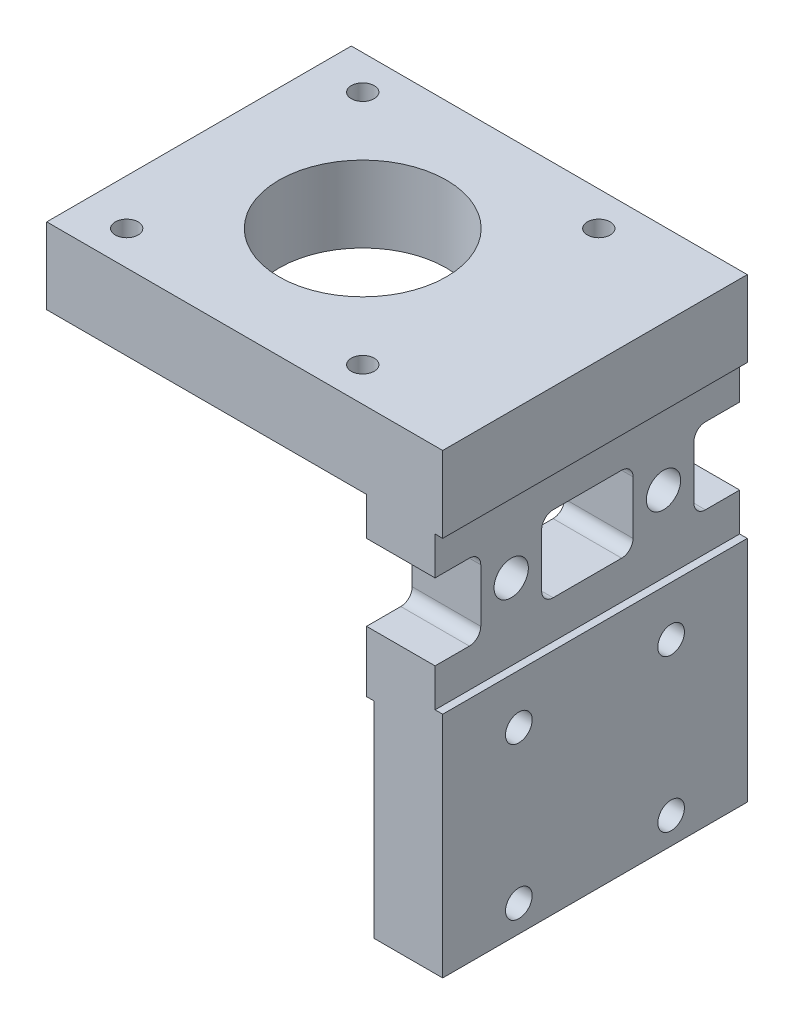
from build123d import *

# Parameters (mm, degrees)
SKETCH1_W           = 40
SKETCH1_H           = 50
BOSS_EXTRUDE1_DEPTH = 10
SKETCH2_W           = 40
SKETCH2_H           = 27
CUT_EXTRUDE1_DEPTH  = 1
SKETCH3_R           = 1.75
CUT_EXTRUDE2_DEPTH  = 10
SKETCH4_W           = 40
SKETCH4_H           = 20
CUT_EXTRUDE3_DEPTH  = 1
SKETCH6_R           = 2.25
CUT_EXTRUDE4_DEPTH  = 10
SKETCH7_W           = 52
SKETCH7_H           = 40
BOSS_EXTRUDE2_DEPTH = 10
SKETCH8_R           = 11
CUT_EXTRUDE5_DEPTH  = 10
SKETCH9_W           = 6
SKETCH9_H           = 10
SKETCH9_W_2         = 12
CUT_EXTRUDE6_DEPTH  = 10
SKETCH10_R          = 1.5
CUT_EXTRUDE7_DEPTH  = 10
FILLET1_R           = 1.5
FILLET2_R           = 1.5


with BuildPart() as part:
    # Sketch1 → Boss-Extrude1 (new body)
    with BuildSketch(Plane(origin=(0, 0, 0), x_dir=(0, 0, -1), z_dir=(1, 0, 0))):
        with Locations((20, 26.83908046)):
            Rectangle(SKETCH1_W, SKETCH1_H)
    extrude(amount=BOSS_EXTRUDE1_DEPTH)

    # Sketch2 → Cut-Extrude1 (cut)
    with BuildSketch(Plane.ZY):
        with Locations((-20, 15.33908046)):
            Rectangle(SKETCH2_W, SKETCH2_H)
    extrude(amount=-CUT_EXTRUDE1_DEPTH, mode=Mode.SUBTRACT)

    # Sketch3 → Cut-Extrude2 (cut)
    with BuildSketch(Plane(origin=(10, 0, 0), x_dir=(0, 0, -1), z_dir=(1, 0, 0))):
        with Locations((10, 25.33908046)):
            Circle(SKETCH3_R)
        with Locations((30, 25.33908046)):
            Circle(SKETCH3_R)
        with Locations((30, 5.33908046)):
            Circle(SKETCH3_R)
        with Locations((10, 5.33908046)):
            Circle(SKETCH3_R)
    extrude(amount=-CUT_EXTRUDE2_DEPTH, mode=Mode.SUBTRACT)

    # Sketch4 → Cut-Extrude3 (cut)
    with BuildSketch(Plane(origin=(10, 0, 0), x_dir=(0, 0, -1), z_dir=(1, 0, 0))):
        with Locations((20, 41.83908046)):
            Rectangle(SKETCH4_W, SKETCH4_H)
    extrude(amount=-CUT_EXTRUDE3_DEPTH, mode=Mode.SUBTRACT)

    # Sketch6 → Cut-Extrude4 (cut)
    with BuildSketch(Plane.ZY):
        with Locations((-30, 41.83908046)):
            Circle(SKETCH6_R)
        with Locations((-10, 41.83908046)):
            Circle(SKETCH6_R)
    extrude(amount=-CUT_EXTRUDE4_DEPTH, mode=Mode.SUBTRACT)

    # Sketch7 → Boss-Extrude2 (add)
    with BuildSketch(Plane(origin=(0, 51.83908046, 0), x_dir=(1, 0, 0), z_dir=(0, 1, 0))):
        with Locations((-16, 20)):
            Rectangle(SKETCH7_W, SKETCH7_H)
    extrude(amount=BOSS_EXTRUDE2_DEPTH)

    # Sketch8 → Cut-Extrude5 (cut)
    with BuildSketch(Plane(origin=(0, 61.83908046, 0), x_dir=(1, 0, 0), z_dir=(0, 1, 0))):
        with Locations(Location((-20.5, 20, 0), (0, 0, 270))):
            Circle(SKETCH8_R)
    extrude(amount=-CUT_EXTRUDE5_DEPTH, mode=Mode.SUBTRACT)

    # Sketch9 → Cut-Extrude6 (cut)
    with BuildSketch(Plane(origin=(9, 0, 0), x_dir=(0, 0, -1), z_dir=(1, 0, 0))):
        with Locations((37, 41.83908046)):
            Rectangle(SKETCH9_W, SKETCH9_H)
        with Locations((20, 41.83908046)):
            Rectangle(SKETCH9_W_2, SKETCH9_H)
        with Locations((3, 41.83908046)):
            Rectangle(SKETCH9_W, SKETCH9_H)
    extrude(amount=-CUT_EXTRUDE6_DEPTH, mode=Mode.SUBTRACT)

    # Sketch10 → Cut-Extrude7 (cut)
    with BuildSketch(Plane(origin=(0, 61.83908046, 0), x_dir=(1, 0, 0), z_dir=(0, 1, 0))):
        with Locations(Location((-36, 35.5, 0), (0, 0, 270))):
            Circle(SKETCH10_R)
        with Locations(Location((-5, 35.5, 0), (0, 0, 270))):
            Circle(SKETCH10_R)
        with Locations(Location((-5, 4.5, 0), (0, 0, 270))):
            Circle(SKETCH10_R)
        with Locations(Location((-36, 4.5, 0), (0, 0, 270))):
            Circle(SKETCH10_R)
    extrude(amount=-CUT_EXTRUDE7_DEPTH, mode=Mode.SUBTRACT)

    # Fillet1
    fillet1_edges = [part.edges().sort_by_distance(p)[0] for p in [
        (4.5, 36.83908046, -14),
        (4.5, 46.83908046, -14),
        (4.5, 46.83908046, -26),
        (4.5, 36.83908046, -26),
    ]]
    fillet(fillet1_edges, radius=FILLET1_R)

    # Fillet2
    fillet2_edges = [part.edges().sort_by_distance(p)[0] for p in [
        (4.5, 36.83908046, -34),
        (4.5, 46.83908046, -34),
        (4.5, 46.83908046, -6),
        (4.5, 36.83908046, -6),
    ]]
    fillet(fillet2_edges, radius=FILLET2_R)


solid = part.part
